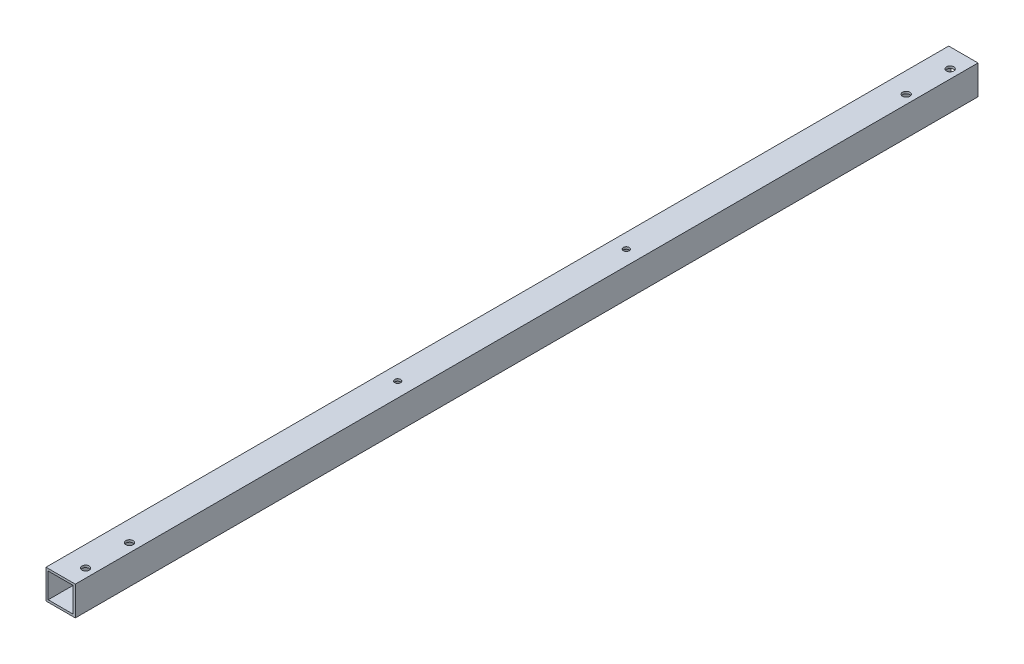
from build123d import *

# Parameters (mm, degrees)
SKETCH_1_W          = 20
SKETCH_1_H          = 20
SKETCH_1_W_2        = 17
SKETCH_1_H_2        = 17
EXTRUDE_1_DEPTH     = 616
SKETCH_4_R          = 2.5
CUT_EXTRUDE_3_DEPTH = 20
SKETCH_5_R          = 2
CUT_EXTRUDE_4_DEPTH = 20


with BuildPart() as part:
    # 草图1 → 凸台-拉伸1 (new body)
    with BuildSketch(Plane.XY):
        Rectangle(SKETCH_1_W, SKETCH_1_H)
        Rectangle(SKETCH_1_W_2, SKETCH_1_H_2, mode=Mode.SUBTRACT)
    extrude(amount=EXTRUDE_1_DEPTH)

    # 草图4 → 切除-拉伸3 (cut)
    with BuildSketch(Plane.XZ.offset(10)):
        with Locations(Location((4, 13, 0), (0, 0, 270))):
            Circle(SKETCH_4_R)
        with Locations(Location((4, 43, 0), (0, 0, 270))):
            Circle(SKETCH_4_R)
        with Locations(Location((4, 603, 0), (0, 0, 270))):
            Circle(SKETCH_4_R)
        with Locations(Location((4, 573, 0), (0, 0, 270))):
            Circle(SKETCH_4_R)
    extrude(amount=-CUT_EXTRUDE_3_DEPTH, mode=Mode.SUBTRACT)

    # 草图5 → 切除-拉伸4 (cut)
    with BuildSketch(Plane.XZ.offset(10)):
        with Locations(Location((0, 230, 0), (0, 0, 270))):
            Circle(SKETCH_5_R)
        with Locations(Location((0, 386, 0), (0, 0, 270))):
            Circle(SKETCH_5_R)
    extrude(amount=-CUT_EXTRUDE_4_DEPTH, mode=Mode.SUBTRACT)


solid = part.part
